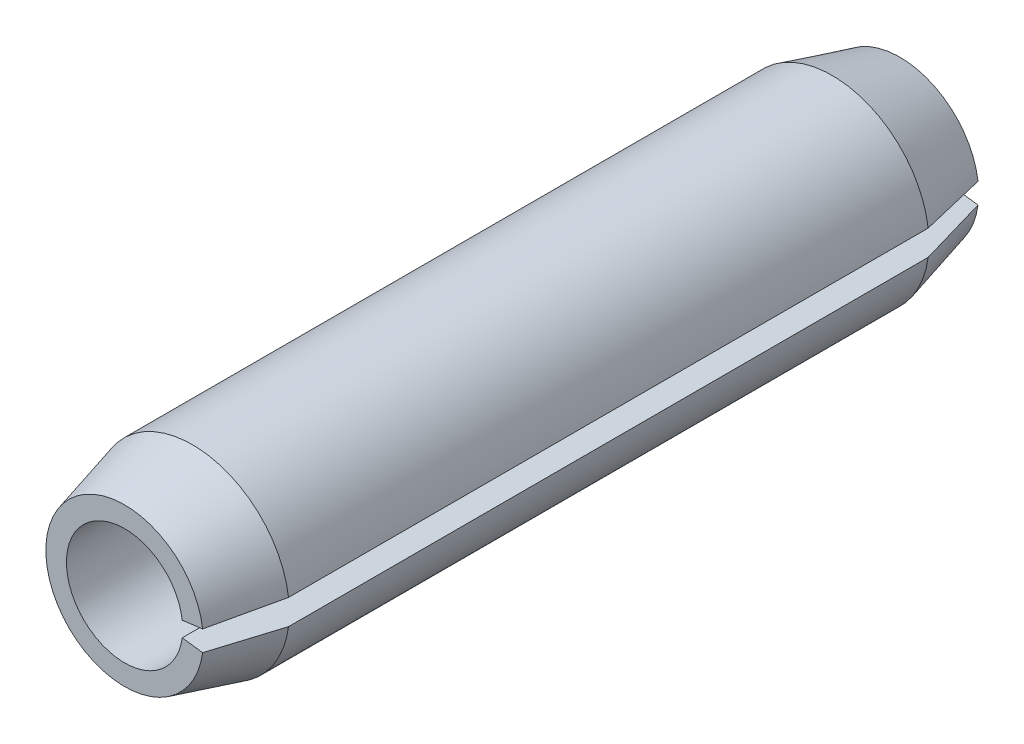
from build123d import *

# Parameters (mm, degrees)
SKICA1_R                 = 0.5
SKICA1_R_2               = 0.3
VYSUNOUT1_DEPTH          = 2
ZKOSIT1_SIZE             = 0.35
ZKOSIT1_SIZE2            = 0.093782217
ODEBRAT_VYSUNUT_M1_DEPTH = 5.062019202


with BuildPart() as part:
    # Skica1 → Vysunout1 (new, symmetric)
    with BuildSketch(Plane.XY):
        Circle(SKICA1_R)
        Circle(SKICA1_R_2, mode=Mode.SUBTRACT)
    extrude(amount=VYSUNOUT1_DEPTH, both=True)

    # Zkosit1
    zkosit1_edges = [part.edges().sort_by_distance(p)[0] for p in [
        (-0.5, 0, -2),
        (-0.5, 0, 2),
    ]]
    zkosit1_side = [part.faces().sort_by_distance(p)[0] for p in [
        (-0.5, 0, 0),
    ]]
    chamfer(zkosit1_edges, length=ZKOSIT1_SIZE, length2=ZKOSIT1_SIZE2, reference=zkosit1_side[0])

    # Skica2 → Odebrat vysunutím1 (cut, through all)
    with BuildSketch(Plane.XY.offset(2)):
        with BuildLine():
            Line((0.495722431, 0.065263096), (0, 0))
            Line((0, 0), (0.495722431, -0.065263096))
            ThreePointArc((0.495722431, -0.065263096), (0.5, 0), (0.495722431, 0.065263096))
        make_face()
    extrude(amount=-ODEBRAT_VYSUNUT_M1_DEPTH, mode=Mode.SUBTRACT)


solid = part.part
